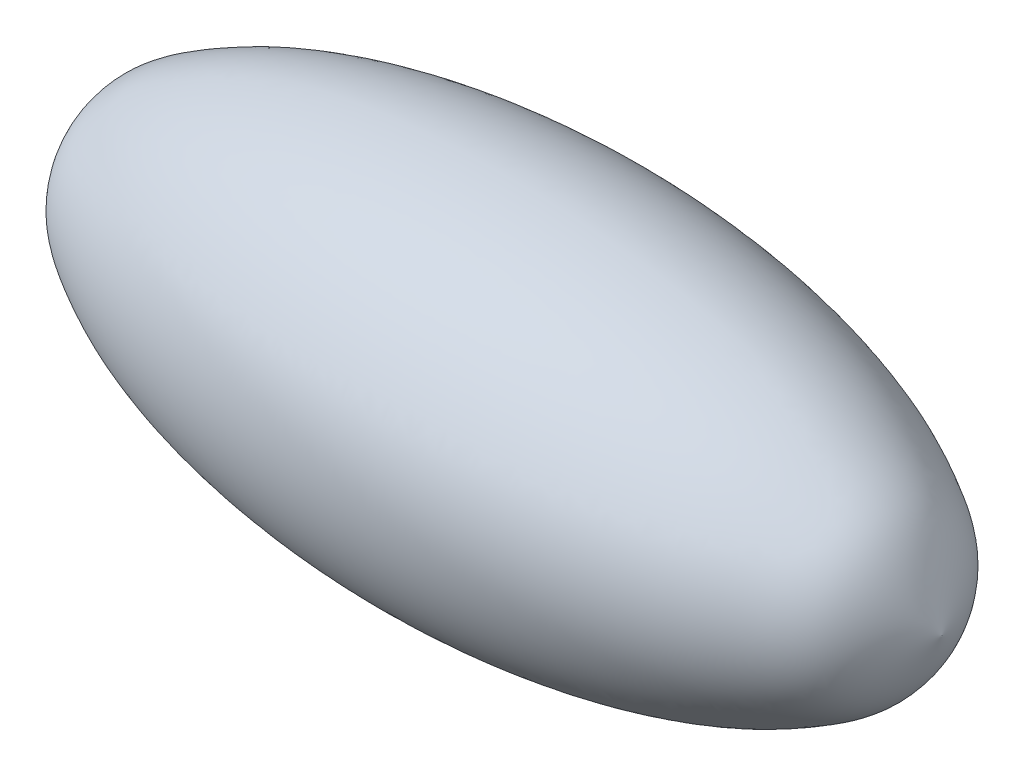
from build123d import *


with BuildPart() as part:
    # Sketch1 → Revolve1 (revolve)
    with BuildSketch(Plane.XY):
        with BuildLine():
            Line((-260, 0), (0, 0))
            add(Edge.make_bspline(
                [(0, 0), (-3.347287608, 8.830491747), (-8.637057756, 22.785453825), (-25.560999876, 33.02157361), (-38.692183286, 39.434199177), (-51.852349815, 44.123794884), (-64.89948422, 47.74936681), (-77.936573384, 50.514956153), (-90.95830586, 52.566616186), (-103.974926365, 53.983885889), (-116.988117972, 54.816743473), (-130, 55.091544132), (-143.011882028, 54.816743473), (-156.025073635, 53.983885889), (-169.04169414, 52.566616186), (-182.063426616, 50.514956153), (-195.10051578, 47.74936681), (-208.147650185, 44.123794884), (-221.307816714, 39.434199177), (-234.439000124, 33.02157361), (-251.362942244, 22.785453825), (-256.652712392, 8.830491747), (-260, 0)],
                knots=[0, 0, 0, 0, 0.090648646, 0.143253451, 0.191238799, 0.237211898, 0.282076785, 0.326262316, 0.37001128, 0.413479751, 0.456779596, 0.5, 0.543220404, 0.586520249, 0.62998872, 0.673737684, 0.717923215, 0.762788102, 0.808761201, 0.856746549, 0.909351354, 1, 1, 1, 1], degree=3))
        make_face()
    revolve(axis=Axis((10, 0, 0), (-1, 0, 0)))


solid = part.part
